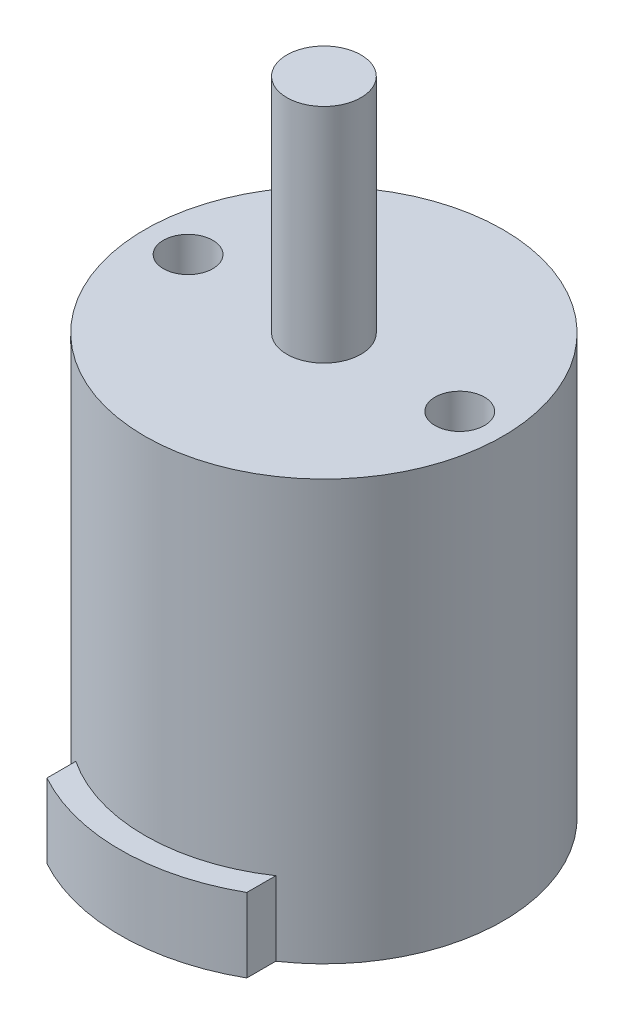
from build123d import *

# Parameters (mm, degrees)
SKETCH_1_R          = 7.25
EXTRUDE_1_DEPTH     = 17
SKETCH_2_R          = 1.5
EXTRUDE_2_DEPTH     = 9
EXTRUDE_3_DEPTH     = 3
SKETCH_4_R          = 1
CUT_EXTRUDE_1_DEPTH = 3


with BuildPart() as part:
    # 草图1 → 凸台-拉伸1 (new body)
    with BuildSketch(Plane(origin=(0, 0, 0), x_dir=(1, 0, 0), z_dir=(0, 1, 0))):
        with Locations(Location((0, 0, 0), (0, 0, 270))):
            Circle(SKETCH_1_R)
    extrude(amount=EXTRUDE_1_DEPTH)

    # 草图2 → 凸台-拉伸2 (add)
    with BuildSketch(Plane(origin=(0, 17, 0), x_dir=(1, 0, 0), z_dir=(0, 1, 0))):
        with Locations(Location((0, 0, 0), (0, 0, 270))):
            Circle(SKETCH_2_R)
    extrude(amount=EXTRUDE_2_DEPTH)

    # 草图3 → 凸台-拉伸3 (add)
    with BuildSketch(Plane.XZ):
        with BuildLine():
            Line((-4, 7.215434845), (-4, 6.006791496))
            Line((-4, 6.006791496), (4.059674361, 6.006791496))
            Line((4.059674361, 6.006791496), (4.059674361, 7.182029245))
            ThreePointArc((4.059674361, 7.182029245), (0.034194164, 8.249929137), (-4, 7.215434845))
        make_face()
    extrude(amount=-EXTRUDE_3_DEPTH)

    # 草图4 → 切除-拉伸1 (cut)
    with BuildSketch(Plane(origin=(0, 17, 0), x_dir=(1, 0, 0), z_dir=(0, 1, 0))):
        with Locations(Location((5.5, 0, 0), (0, 0, 270))):
            Circle(SKETCH_4_R)
        with Locations(Location((-5.5, 0, 0), (0, 0, 270))):
            Circle(SKETCH_4_R)
    extrude(amount=-CUT_EXTRUDE_1_DEPTH, mode=Mode.SUBTRACT)


solid = part.part
